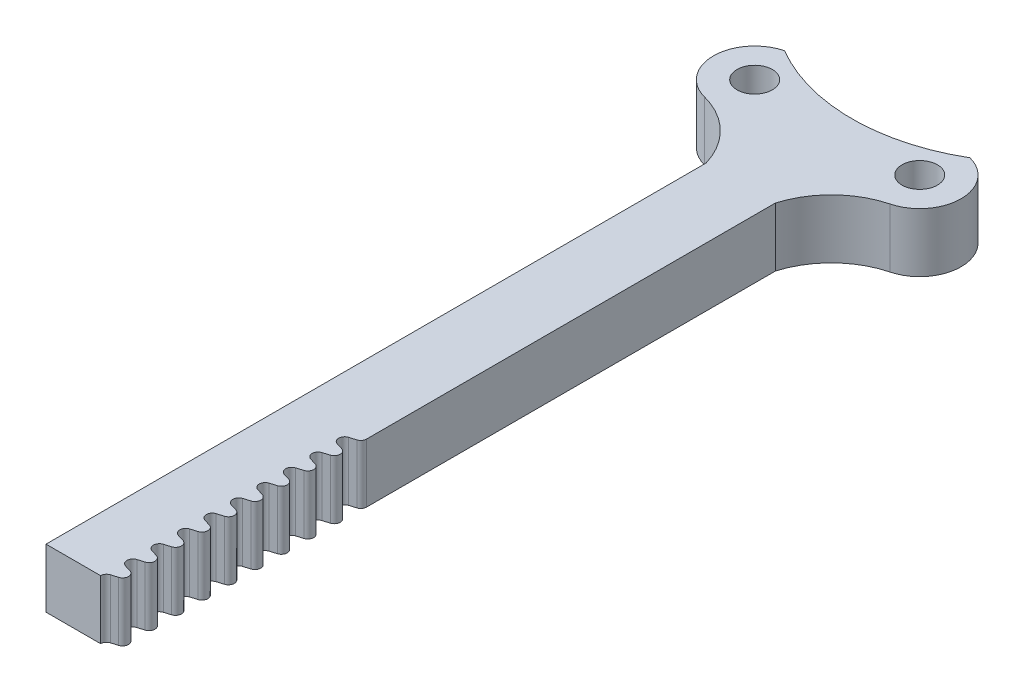
from build123d import *

# Parameters (mm, degrees)
BOSS_EXTRU_1_DEPTH      = 2.5
BOSS_EXTRU_1_DEPTH_BACK = 2.5
ESQUISSE1_R             = 1.5


with BuildPart() as part:
    # Esquisse1 → Boss.-Extru.1 (new, two sides: drawn at the far end of the back side and taken through both)
    with BuildSketch(Plane(origin=(0, 0, 0), x_dir=(1, 0, 0), z_dir=(0, 1, 0)).offset(-BOSS_EXTRU_1_DEPTH_BACK)):
        with BuildLine():
            Line((1.688009203, -65), (-2.938009191, -65))
            Line((-2.938009191, -65), (-2.938009191, -9.008494736))
            ThreePointArc((-2.938009191, -9.008494736), (-4.78031572, -5.95992834), (-7.884337553, -4.212673672))
            ThreePointArc((-7.884337553, -4.212673672), (-10.499981587, -0.814885018), (-7.862349987, 2.565863566))
            ThreePointArc((-7.862349987, 2.565863566), (0, 0.423762079), (7.862349987, 2.565863566))
            ThreePointArc((7.862349987, 2.565863566), (10.499981587, -0.814885018), (7.884337553, -4.212673672))
            ThreePointArc((7.884337553, -4.212673672), (4.78031572, -5.95992834), (2.938009191, -9.008494736))
            Line((2.938009191, -9.008494736), (2.938009191, -43.679635922))
            ThreePointArc((2.938009191, -43.679635922), (2.839937622, -43.977047315), (2.584195047, -44.1577883))
            Line((2.584195047, -44.1577883), (2.041823351, -44.323607971))
            ThreePointArc((2.041823351, -44.323607971), (1.688009203, -44.801760349), (2.041823351, -45.279912727))
            Line((2.041823351, -45.279912727), (2.584195044, -45.445732395))
            ThreePointArc((2.584195044, -45.445732395), (2.839937622, -45.626473379), (2.938009191, -45.923884773))
            ThreePointArc((2.938009191, -45.923884773), (2.839937622, -46.221296165), (2.584195047, -46.40203715))
            Line((2.584195047, -46.40203715), (2.041823351, -46.567856821))
            ThreePointArc((2.041823351, -46.567856821), (1.688009203, -47.046009199), (2.041823351, -47.524161577))
            Line((2.041823351, -47.524161577), (2.584195044, -47.689981245))
            ThreePointArc((2.584195044, -47.689981245), (2.839937622, -47.870722229), (2.938009191, -48.168133623))
            ThreePointArc((2.938009191, -48.168133623), (2.839937622, -48.465545015), (2.584195047, -48.646286))
            Line((2.584195047, -48.646286), (2.041823351, -48.812105672))
            ThreePointArc((2.041823351, -48.812105672), (1.688009203, -49.290258049), (2.041823351, -49.768410427))
            Line((2.041823351, -49.768410427), (2.584195044, -49.934230095))
            ThreePointArc((2.584195044, -49.934230095), (2.839937622, -50.114971079), (2.938009191, -50.412382473))
            ThreePointArc((2.938009191, -50.412382473), (2.839937622, -50.709793865), (2.584195047, -50.89053485))
            Line((2.584195047, -50.89053485), (2.041823351, -51.056354522))
            ThreePointArc((2.041823351, -51.056354522), (1.688009203, -51.5345069), (2.041823351, -52.012659278))
            Line((2.041823351, -52.012659278), (2.584195044, -52.178478945))
            ThreePointArc((2.584195044, -52.178478945), (2.839937622, -52.359219929), (2.938009191, -52.656631323))
            ThreePointArc((2.938009191, -52.656631323), (2.839937622, -52.954042715), (2.584195047, -53.1347837))
            Line((2.584195047, -53.1347837), (2.041823351, -53.300603372))
            ThreePointArc((2.041823351, -53.300603372), (1.688009203, -53.77875575), (2.041823351, -54.256908128))
            Line((2.041823351, -54.256908128), (2.584195044, -54.422727795))
            ThreePointArc((2.584195044, -54.422727795), (2.839937622, -54.603468779), (2.938009191, -54.900880173))
            ThreePointArc((2.938009191, -54.900880173), (2.839937622, -55.198291565), (2.584195047, -55.37903255))
            Line((2.584195047, -55.37903255), (2.041823351, -55.544852222))
            ThreePointArc((2.041823351, -55.544852222), (1.688009203, -56.0230046), (2.041823351, -56.501156978))
            Line((2.041823351, -56.501156978), (2.584195044, -56.666976645))
            ThreePointArc((2.584195044, -56.666976645), (2.839937622, -56.84771763), (2.938009191, -57.145129023))
            ThreePointArc((2.938009191, -57.145129023), (2.839937622, -57.442540415), (2.584195047, -57.6232814))
            Line((2.584195047, -57.6232814), (2.041823351, -57.789101072))
            ThreePointArc((2.041823351, -57.789101072), (1.688009203, -58.26725345), (2.041823351, -58.745405828))
            Line((2.041823351, -58.745405828), (2.584195044, -58.911225495))
            ThreePointArc((2.584195044, -58.911225495), (2.839937622, -59.09196648), (2.938009191, -59.389377873))
            ThreePointArc((2.938009191, -59.389377873), (2.839937622, -59.686789265), (2.584195047, -59.86753025))
            Line((2.584195047, -59.86753025), (2.041823351, -60.033349922))
            ThreePointArc((2.041823351, -60.033349922), (1.688009203, -60.5115023), (2.041823351, -60.989654678))
            Line((2.041823351, -60.989654678), (2.584195044, -61.155474345))
            ThreePointArc((2.584195044, -61.155474345), (2.839937622, -61.33621533), (2.938009191, -61.633626723))
            ThreePointArc((2.938009191, -61.633626723), (2.839937622, -61.931038115), (2.584195047, -62.1117791))
            Line((2.584195047, -62.1117791), (2.041823351, -62.277598772))
            ThreePointArc((2.041823351, -62.277598772), (1.688009203, -62.75575115), (2.041823351, -63.233903528))
            Line((2.041823351, -63.233903528), (2.584195044, -63.399723195))
            ThreePointArc((2.584195044, -63.399723195), (2.839937622, -63.58046418), (2.938009191, -63.877875573))
            ThreePointArc((2.938009191, -63.877875573), (2.839937622, -64.175286965), (2.584195047, -64.35602795))
            Line((2.584195047, -64.35602795), (2.041823351, -64.521847622))
            ThreePointArc((2.041823351, -64.521847622), (1.786080773, -64.702588607), (1.688009203, -65))
        make_face()
        with Locations((7, -0.826237921)):
            Circle(ESQUISSE1_R, mode=Mode.SUBTRACT)
        with Locations((-7, -0.826237921)):
            Circle(ESQUISSE1_R, mode=Mode.SUBTRACT)
    extrude(amount=BOSS_EXTRU_1_DEPTH + BOSS_EXTRU_1_DEPTH_BACK)


solid = part.part
